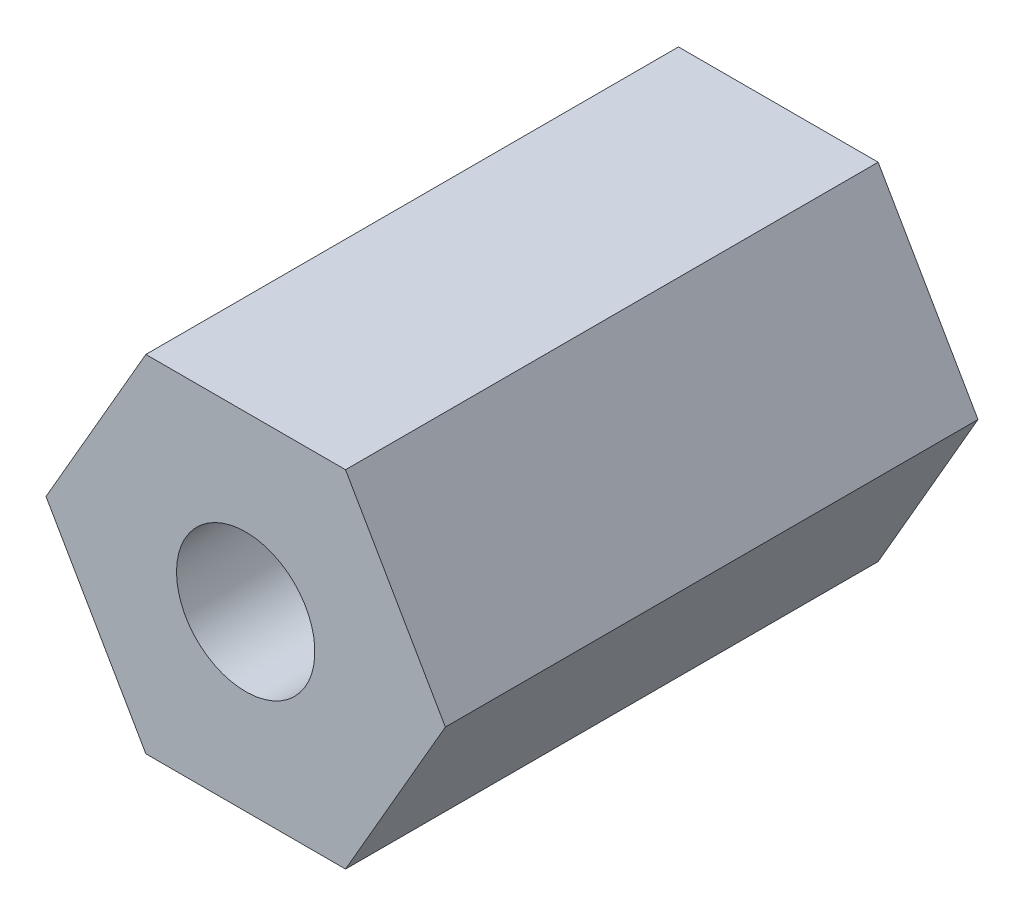
from build123d import *

# Parameters (mm, degrees)
SKETCH_1_R      = 2
EXTRUDE_1_DEPTH = 15.4


with BuildPart() as part:
    # 草图1 → 凸台-拉伸1 (new body)
    with BuildSketch(Plane.XY):
        Polygon((2.886751346, -5), (5.773502692, 0), (2.886751346, 5), (-2.886751346, 5), (-5.773502692, 0), (-2.886751346, -5), align=None)
        with Locations(Location((0, 0, 0), (0, 0, 180))):
            Circle(SKETCH_1_R, mode=Mode.SUBTRACT)
    extrude(amount=EXTRUDE_1_DEPTH)


solid = part.part
